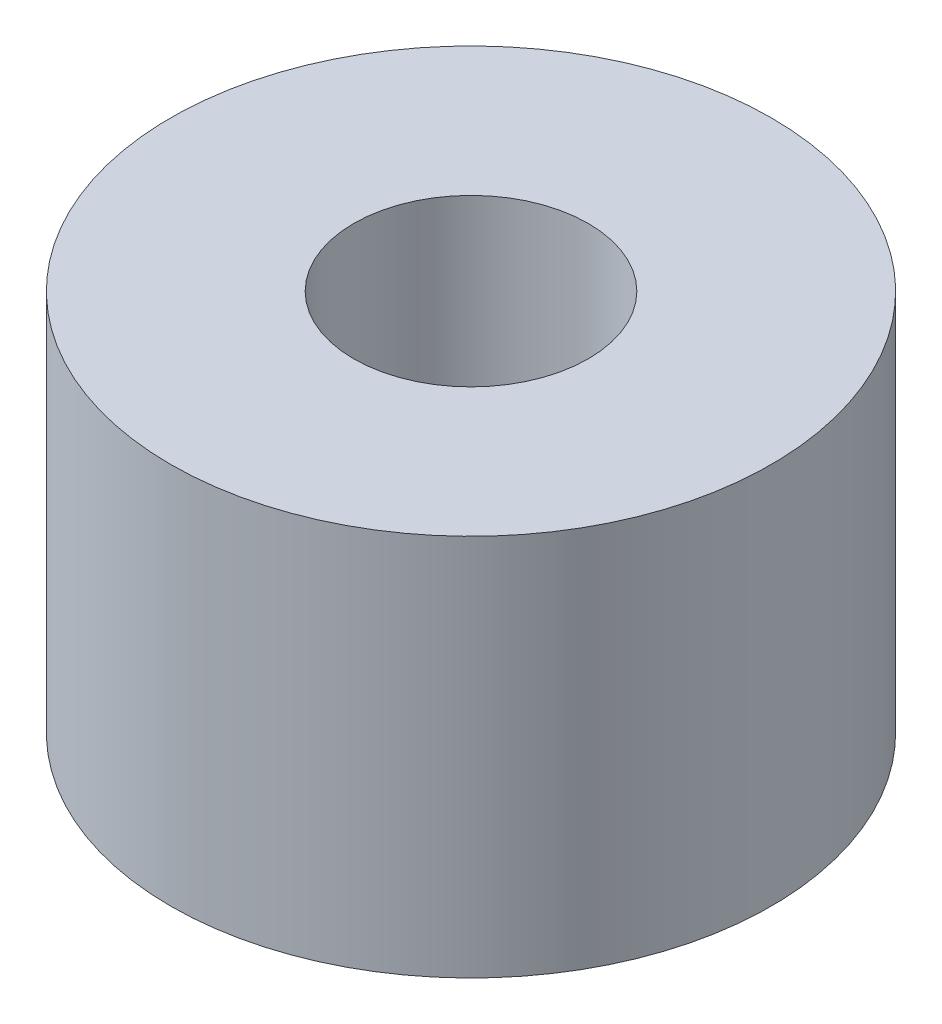
from build123d import *

# Parameters (mm, degrees)
SKETCH1_R                    = 12.7
BOSS_EXTRUDE1_DEPTH          = 16.1798
F_7_16_20_TAPPED_HOLE1_D     = 9.92124
F_7_16_20_TAPPED_HOLE1_DEPTH = 10.024158796
F_7_16_20_TAPPED_HOLE1_TIP   = 2.980641204


with BuildPart() as part:
    # Sketch1 → Boss-Extrude1 (new body)
    with BuildSketch(Plane(origin=(0, 0, 0), x_dir=(1, 0, 0), z_dir=(0, 1, 0))):
        with Locations(Location((0, 0, 0), (0, 0, 270))):
            Circle(SKETCH1_R)
    extrude(amount=BOSS_EXTRUDE1_DEPTH)

    # 7/16-20 Tapped Hole1
    with Locations(Plane(origin=(0, 16.1798, 0), x_dir=(1, 0, 0), z_dir=(0, 1, 0))):
        with Locations((0, 0)):
            Hole(F_7_16_20_TAPPED_HOLE1_D / 2, depth=F_7_16_20_TAPPED_HOLE1_DEPTH)
            with Locations((0, 0, -(F_7_16_20_TAPPED_HOLE1_DEPTH + F_7_16_20_TAPPED_HOLE1_TIP / 2))):  # 118° drill point
                Cone(0, F_7_16_20_TAPPED_HOLE1_D / 2, F_7_16_20_TAPPED_HOLE1_TIP, mode=Mode.SUBTRACT)


solid = part.part
